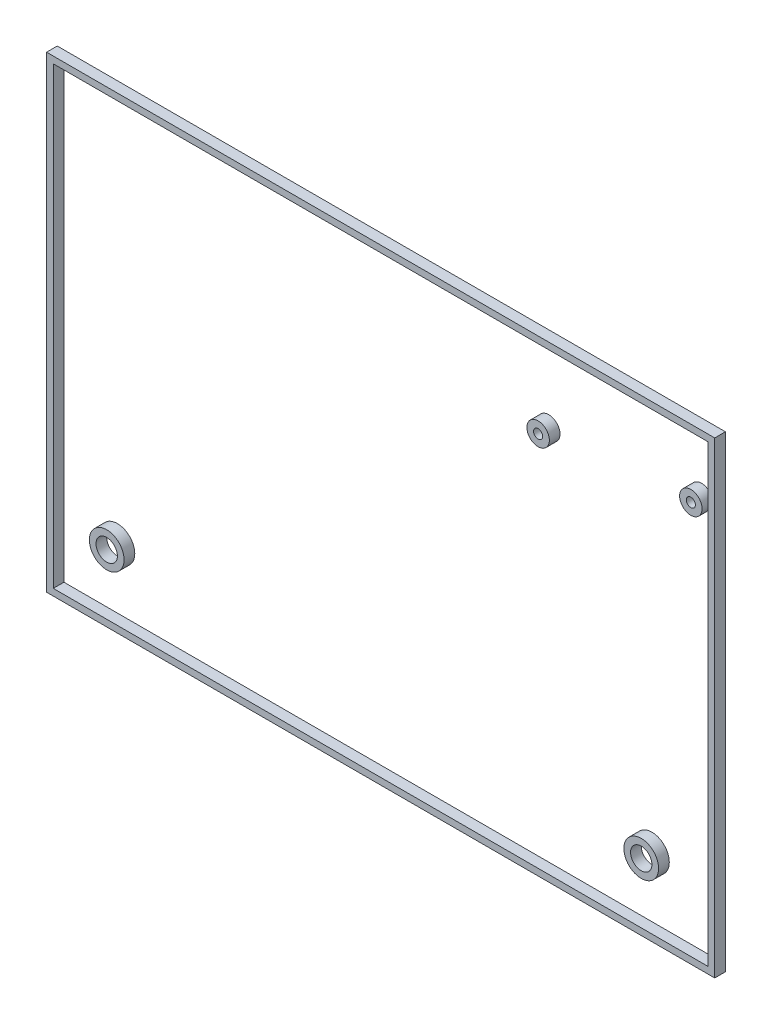
from build123d import *

# Parameters (mm, degrees)
BOSS_EXTRUDE1_DEPTH        = 0.8
BOSS_EXTRUDE1_DEPTH_BACK   = 0.8
SKETCH1_W                  = 100
SKETCH1_H                  = 70
SKETCH1_W_2                = 98
SKETCH1_H_2                = 68
BOSS_EXTRUDE1_2_DEPTH      = 0.8
BOSS_EXTRUDE1_2_DEPTH_BACK = 0.8
SKETCH1_R                  = 2.6
SKETCH1_R_2                = 1.6
BOSS_EXTRUDE1_3_DEPTH      = 0.8
BOSS_EXTRUDE1_3_DEPTH_BACK = 0.8
BOSS_EXTRUDE1_4_DEPTH      = 0.8
BOSS_EXTRUDE1_4_DEPTH_BACK = 0.8
SKETCH1_R_3                = 1.68
SKETCH1_R_4                = 0.68
BOSS_EXTRUDE1_5_DEPTH      = 0.8
BOSS_EXTRUDE1_5_DEPTH_BACK = 0.8


with BuildPart() as part:
    # Sketch1 → Boss-Extrude1 (new, two sides: drawn at the far end of the back side and taken through both)
    with BuildSketch(Plane.XY.offset(-BOSS_EXTRUDE1_DEPTH_BACK)):
        with Locations((156, -70)):
            Rectangle(SKETCH1_W, SKETCH1_H)
        with Locations((156, -70)):
            Rectangle(SKETCH1_W_2, SKETCH1_H_2, mode=Mode.SUBTRACT)
    extrude(amount=BOSS_EXTRUDE1_DEPTH + BOSS_EXTRUDE1_DEPTH_BACK)


with BuildPart() as body_2:
    # Sketch1 → Boss-Extrude1 2 (new, two sides: drawn at the far end of the back side and taken through both)
    with BuildSketch(Plane.XY.offset(-BOSS_EXTRUDE1_2_DEPTH_BACK)):
        with Locations((115, -95)):
            Circle(SKETCH1_R)
        with Locations((115, -95)):
            Circle(SKETCH1_R_2, mode=Mode.SUBTRACT)
    extrude(amount=BOSS_EXTRUDE1_2_DEPTH + BOSS_EXTRUDE1_2_DEPTH_BACK)


with BuildPart() as body_3:
    # Sketch1 → Boss-Extrude1 3 (new, two sides: drawn at the far end of the back side and taken through both)
    with BuildSketch(Plane.XY.offset(-BOSS_EXTRUDE1_3_DEPTH_BACK)):
        with Locations((195, -95)):
            Circle(SKETCH1_R)
        with Locations((195, -95)):
            Circle(SKETCH1_R_2, mode=Mode.SUBTRACT)
    extrude(amount=BOSS_EXTRUDE1_3_DEPTH + BOSS_EXTRUDE1_3_DEPTH_BACK)


with BuildPart() as body_4:
    # Sketch1 → Boss-Extrude1 4 (new, two sides: drawn at the far end of the back side and taken through both)
    with BuildSketch(Plane.XY.offset(-BOSS_EXTRUDE1_4_DEPTH_BACK)):
        with Locations((179.565, -47.682)):
            Circle(SKETCH1_R_3)
        with Locations((179.565, -47.682)):
            Circle(SKETCH1_R_4, mode=Mode.SUBTRACT)
    extrude(amount=BOSS_EXTRUDE1_4_DEPTH + BOSS_EXTRUDE1_4_DEPTH_BACK)


with BuildPart() as body_5:
    # Sketch1 → Boss-Extrude1 5 (new, two sides: drawn at the far end of the back side and taken through both)
    with BuildSketch(Plane.XY.offset(-BOSS_EXTRUDE1_5_DEPTH_BACK)):
        with Locations((202.425, -45.142)):
            Circle(SKETCH1_R_3)
        with Locations((202.425, -45.142)):
            Circle(SKETCH1_R_4, mode=Mode.SUBTRACT)
    extrude(amount=BOSS_EXTRUDE1_5_DEPTH + BOSS_EXTRUDE1_5_DEPTH_BACK)


solid = Compound([part.part, body_2.part, body_3.part, body_4.part, body_5.part])
